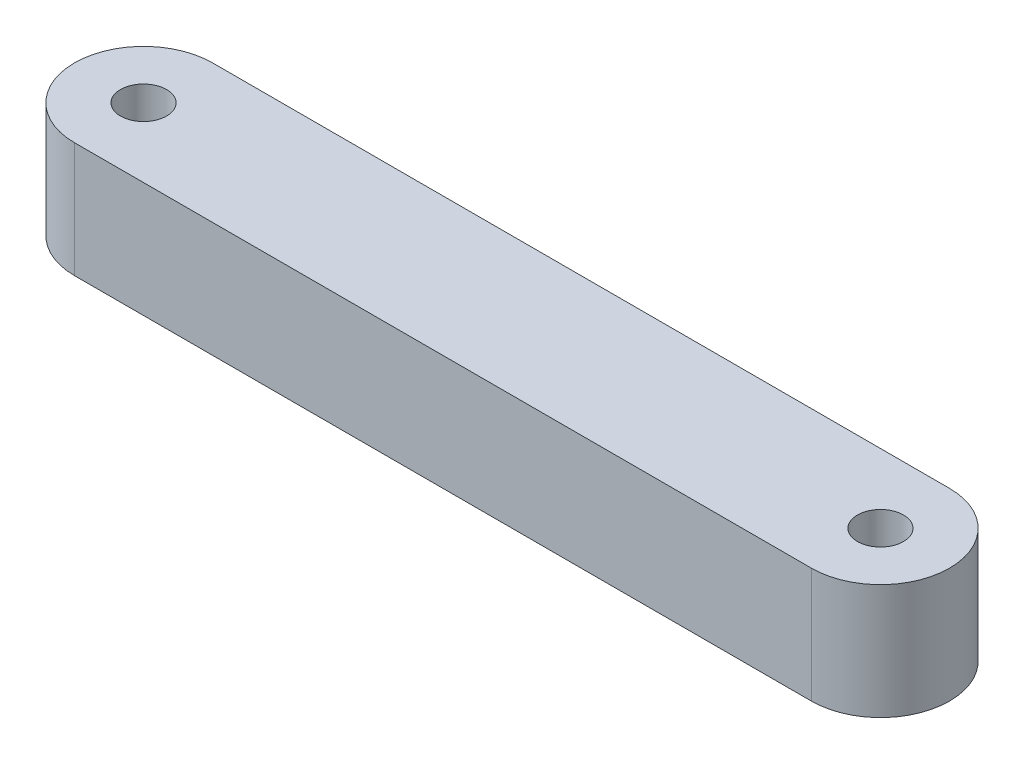
from build123d import *

# Parameters (mm, degrees)
BOSS_EXTRUDE1_DEPTH = 12.7
SKETCH4_R           = 2.54
CUT_EXTRUDE3_DEPTH  = 61.26815743


with BuildPart() as part:
    # Sketch3 → Boss-Extrude1 (new body)
    with BuildSketch(Plane(origin=(0, 0, 0), x_dir=(1, 0, 0), z_dir=(0, 1, 0))):
        with BuildLine():
            Line((-50.8, 7.62), (30.48, 7.62))
            ThreePointArc((30.48, 7.62), (38.1, 0), (30.48, -7.62))
            Line((30.48, -7.62), (-50.8, -7.62))
            ThreePointArc((-50.8, -7.62), (-58.42, 0), (-50.8, 7.62))
        make_face()
    extrude(amount=BOSS_EXTRUDE1_DEPTH)

    # Sketch4 → Cut-Extrude3 (cut, through all)
    with BuildSketch(Plane(origin=(0, 12.7, 0), x_dir=(1, 0, 0), z_dir=(0, 1, 0))):
        with Locations(Location((-50.8, 0, 0), (0, 0, 270))):
            Circle(SKETCH4_R)
        with Locations(Location((30.48, 0, 0), (0, 0, 90))):
            Circle(SKETCH4_R)
    extrude(amount=-CUT_EXTRUDE3_DEPTH, mode=Mode.SUBTRACT)


solid = part.part
